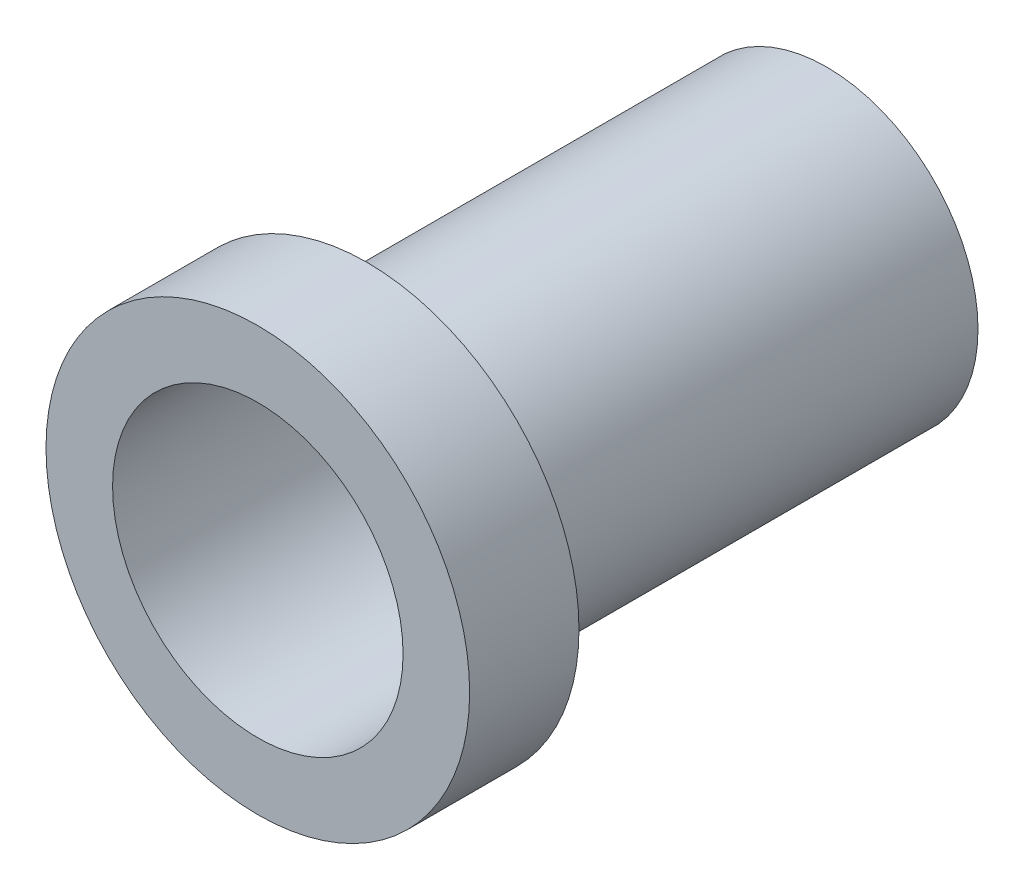
from build123d import *

# Parameters (mm, degrees)
SKETCH_1_R           = 12.5
SKETCH_1_R_2         = 12
EXTRUDE_1_DEPTH      = 40
EXTRUDE_2_DEPTH      = 7
EXTRUDE_2_DEPTH_BACK = 1.034218613
SKETCH_2_R           = 17.5
SKETCH_2_R_2         = 12
SKETCH_3_R           = 17.5
EXTRUDE_3_DEPTH      = 1
SKETCH_4_R           = 12
CUT_EXTRUDE_1_DEPTH  = 1


with BuildPart() as part:
    # Эскиз1 → Бобышка-Вытянуть1 (new body)
    with BuildSketch(Plane.XY):
        Circle(SKETCH_1_R)
        Circle(SKETCH_1_R_2, mode=Mode.SUBTRACT)
    extrude(amount=EXTRUDE_1_DEPTH)

    # Эскиз2 → Бобышка-Вытянуть2 (add, two sides: drawn at the far end of the back side and taken through both)
    with BuildSketch(Plane.XY.offset(40).offset(-EXTRUDE_2_DEPTH_BACK)):
        Circle(SKETCH_2_R)
        Circle(SKETCH_2_R_2, mode=Mode.SUBTRACT)
    extrude(amount=EXTRUDE_2_DEPTH + EXTRUDE_2_DEPTH_BACK)

    # Эскиз3 → Бобышка-Вытянуть3 (add)
    with BuildSketch(Plane(origin=(0, 0, 38.965781387), x_dir=(-1, 0, 0), z_dir=(0, 0, -1))):
        with Locations(Location((0, 0, 0), (0, 0, 180))):
            Circle(SKETCH_3_R)
    extrude(amount=EXTRUDE_3_DEPTH)

    # Эскиз4 → Вырез-Вытянуть1 (cut)
    with BuildSketch(Plane(origin=(0, 0, 37.965781387), x_dir=(-1, 0, 0), z_dir=(0, 0, -1))):
        with Locations(Location((0, 0, 0), (0, 0, 180))):
            Circle(SKETCH_4_R)
    extrude(amount=-CUT_EXTRUDE_1_DEPTH, mode=Mode.SUBTRACT)


solid = part.part
